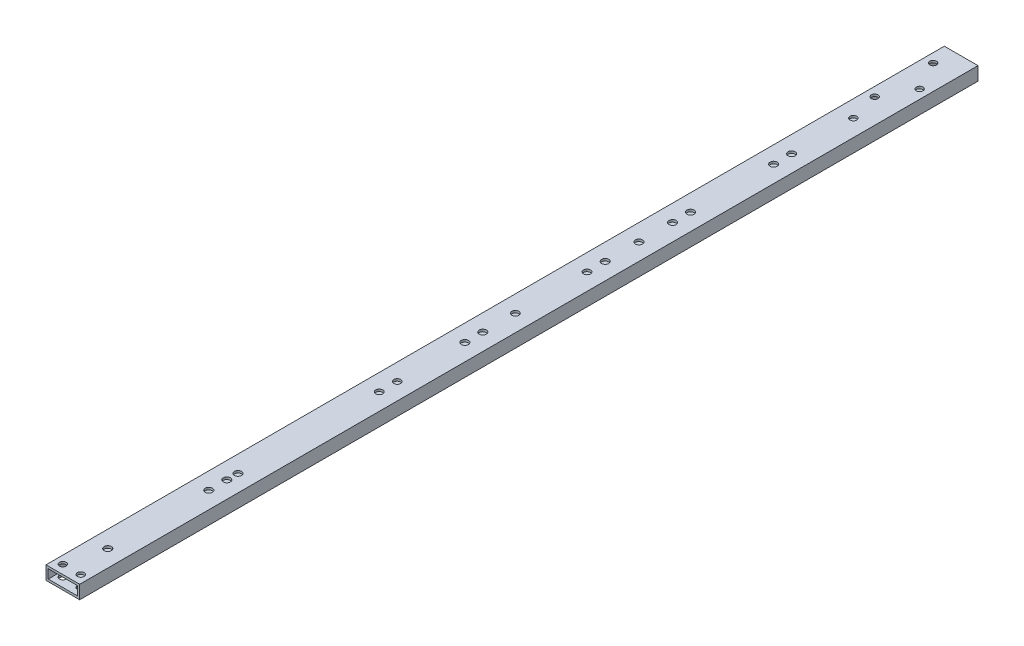
from build123d import *

# Parameters (mm, degrees)
SKETCH_1_W          = 15
SKETCH_1_H          = 6
SKETCH_1_W_2        = 13
SKETCH_1_H_2        = 4
EXTRUDE_1_DEPTH     = 400
SKETCH_2_R          = 1.5
CUT_EXTRUDE_1_DEPTH = 10
SKETCH_3_R          = 1.6
SKETCH_3_R_2        = 1.55
CUT_EXTRUDE_2_DEPTH = 10
SKETCH_4_R          = 1.55
SKETCH_4_R_2        = 1.5
CUT_EXTRUDE_3_DEPTH = 401.115295884


with BuildPart() as part:
    # 草图1 → 凸台-拉伸1 (new body)
    with BuildSketch(Plane.XY):
        Rectangle(SKETCH_1_W, SKETCH_1_H)
        Rectangle(SKETCH_1_W_2, SKETCH_1_H_2, mode=Mode.SUBTRACT)
    extrude(amount=EXTRUDE_1_DEPTH)

    # 草图2 → 切除-拉伸1 (cut)
    with BuildSketch(Plane.XZ.offset(3)):
        with Locations(Location((-3.5, 35, 0), (0, 0, 270))):
            Circle(SKETCH_2_R)
        with Locations(Location((-3.5, 9, 0), (0, 0, 270))):
            Circle(SKETCH_2_R)
        with Locations(Location((3.5, 22, 0), (0, 0, 270))):
            Circle(SKETCH_2_R)
        with Locations(Location((0, 48, 0), (0, 0, 270))):
            Circle(SKETCH_2_R)
    extrude(amount=-CUT_EXTRUDE_1_DEPTH, mode=Mode.SUBTRACT)

    # 草图3 → 切除-拉伸2 (cut)
    with BuildSketch(Plane(origin=(0, 3, 0), x_dir=(1, 0, 0), z_dir=(0, 1, 0))):
        with Locations(Location((0, -322, 0), (0, 0, 270))):
            Circle(SKETCH_3_R)
        with Locations(Location((0, -327, 0), (0, 0, 270))):
            Circle(SKETCH_3_R)
        with Locations(Location((0, -335, 0), (0, 0, 270))):
            Circle(SKETCH_3_R)
        with Locations(Location((0, -380, 0), (0, 0, 270))):
            Circle(SKETCH_3_R)
        with Locations(Location((0, -213, 0), (0, 0, 270))):
            Circle(SKETCH_3_R)
        with Locations(Location((0, -221, 0), (0, 0, 270))):
            Circle(SKETCH_3_R)
        with Locations(Location((0, -198.5, 0), (0, 0, 270))):
            Circle(SKETCH_3_R_2)
        with Locations(Location((0, -158.5, 0), (0, 0, 270))):
            Circle(SKETCH_3_R)
        with Locations(Location((0, -143.5, 0), (0, 0, 270))):
            Circle(SKETCH_3_R)
        with Locations(Location((0, -128.5, 0), (0, 0, 270))):
            Circle(SKETCH_3_R)
        with Locations(Location((0, -120.5, 0), (0, 0, 270))):
            Circle(SKETCH_3_R)
        with Locations(Location((0, -75.5, 0), (0, 0, 270))):
            Circle(SKETCH_3_R)
        with Locations(Location((0, -83.5, 0), (0, 0, 270))):
            Circle(SKETCH_3_R)
    extrude(amount=-CUT_EXTRUDE_2_DEPTH, mode=Mode.SUBTRACT)

    # 草图4 → 切除-拉伸3 (cut, through all)
    with BuildSketch(Plane(origin=(0, 3, 0), x_dir=(1, 0, 0), z_dir=(0, 1, 0))):
        with Locations(Location((0, -251.1, 0), (0, 0, 270))):
            Circle(SKETCH_4_R)
        with Locations(Location((0, -259.1, 0), (0, 0, 270))):
            Circle(SKETCH_4_R)
        with Locations(Location((0, -166.6, 0), (0, 0, 270))):
            Circle(SKETCH_4_R)
        with Locations(Location((-4, -396, 0), (0, 0, 270))):
            Circle(SKETCH_4_R_2)
        with Locations(Location((4, -396, 0), (0, 0, 270))):
            Circle(SKETCH_4_R_2)
    extrude(amount=-CUT_EXTRUDE_3_DEPTH, mode=Mode.SUBTRACT)


solid = part.part
